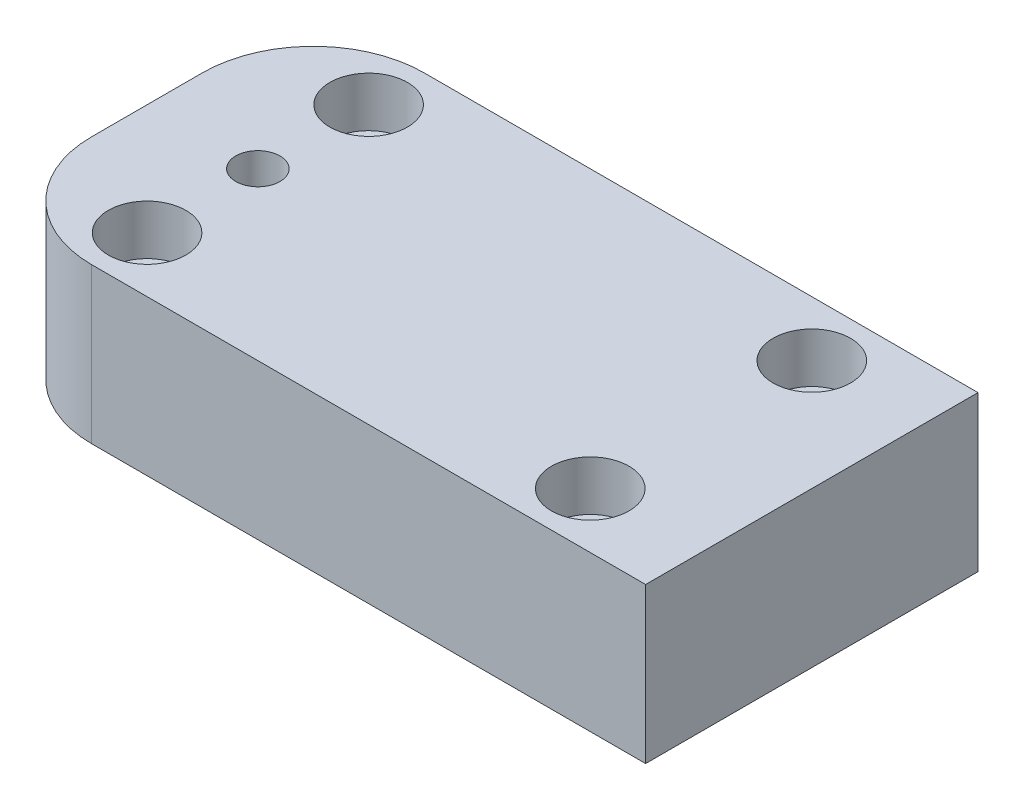
from build123d import *

# Parameters (mm, degrees)
SKETCH_1_W          = 60
SKETCH_1_H          = 30
SKETCH_1_R          = 2
SKETCH_1_R_2        = 1.75
EXTRUDE_1_DEPTH     = 14
FILLET_1_R          = 10
SKETCH_2_R          = 3.5
CUT_EXTRUDE_1_DEPTH = 4.5


with BuildPart() as part:
    # 草图1 → 凸台-拉伸1 (new body)
    with BuildSketch(Plane(origin=(0, 0, 0), x_dir=(1, 0, 0), z_dir=(0, 1, 0))):
        Rectangle(SKETCH_1_W, SKETCH_1_H)
        with Locations(Location((-20, 0, 0), (0, 0, 270))):
            Circle(SKETCH_1_R, mode=Mode.SUBTRACT)
        with Locations(Location((-20, 10, 0), (0, 0, 270))):
            Circle(SKETCH_1_R_2, mode=Mode.SUBTRACT)
        with Locations(Location((20, 10, 0), (0, 0, 270))):
            Circle(SKETCH_1_R_2, mode=Mode.SUBTRACT)
        with Locations(Location((-20, -10, 0), (0, 0, 270))):
            Circle(SKETCH_1_R_2, mode=Mode.SUBTRACT)
        with Locations(Location((20, -10, 0), (0, 0, 270))):
            Circle(SKETCH_1_R_2, mode=Mode.SUBTRACT)
    extrude(amount=EXTRUDE_1_DEPTH)

    # 圆角1
    fillet_1_edges = [part.edges().sort_by_distance(p)[0] for p in [
        (-30, 7, 15),
        (-30, 7, -15),
    ]]
    fillet(fillet_1_edges, radius=FILLET_1_R)

    # 草图2 → 切除-拉伸1 (cut)
    with BuildSketch(Plane(origin=(0, 14, 0), x_dir=(1, 0, 0), z_dir=(0, 1, 0))):
        with Locations(Location((-20, 10, 0), (0, 0, 270))):
            Circle(SKETCH_2_R)
        with Locations(Location((-20, -10, 0), (0, 0, 270))):
            Circle(SKETCH_2_R)
        with Locations(Location((20, 10, 0), (0, 0, 270))):
            Circle(SKETCH_2_R)
        with Locations(Location((20, -10, 0), (0, 0, 270))):
            Circle(SKETCH_2_R)
    extrude(amount=-CUT_EXTRUDE_1_DEPTH, mode=Mode.SUBTRACT)


solid = part.part
